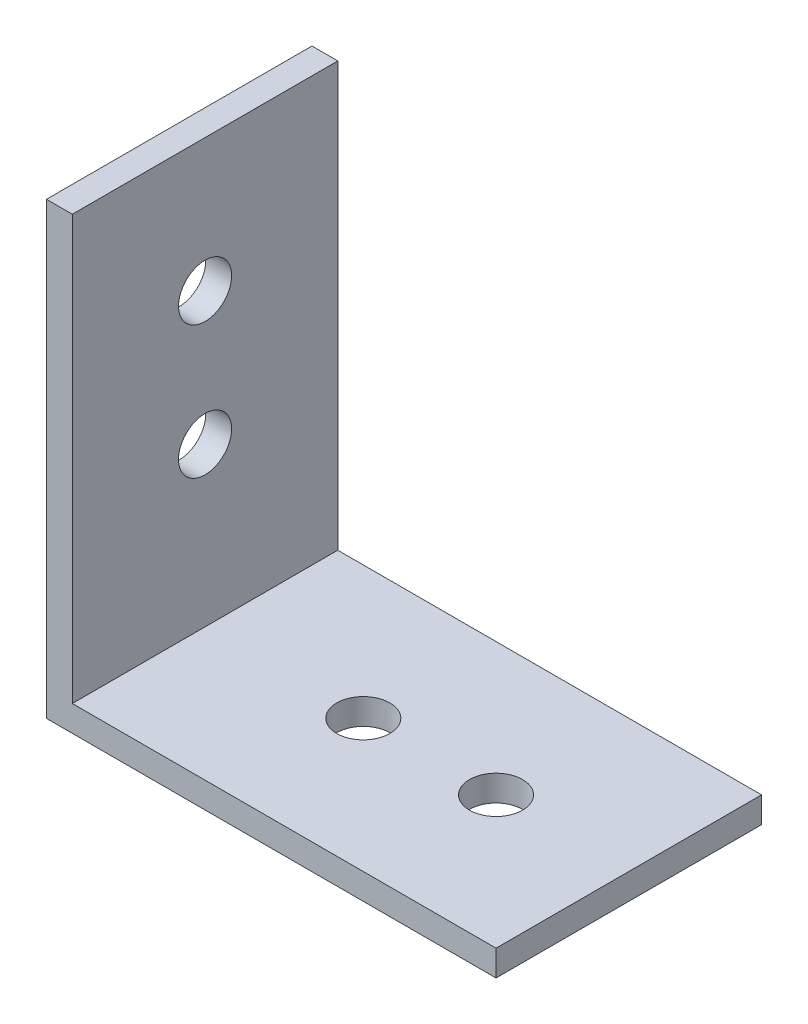
from build123d import *

# Parameters (mm, degrees)
SKETCH1_W           = 15
SKETCH1_H           = 25.4
BOSS_EXTRUDE1_DEPTH = 3.175
SKETCH2_W           = 15
SKETCH2_H           = 3.175
BOSS_EXTRUDE2_DEPTH = 22.225
SKETCH4_R           = 1.5
CUT_EXTRUDE3_DEPTH  = 37.933868265
SKETCH3_R           = 1.5
CUT_EXTRUDE4_DEPTH  = 39.927111375
SKETCH7_W           = 22.225
SKETCH7_H           = 15
CUT_EXTRUDE7_DEPTH  = 1.7145
SKETCH8_W           = 15
SKETCH8_H           = 23.9395
CUT_EXTRUDE8_DEPTH  = 1.7145


with BuildPart() as part:
    # Sketch1 → Boss-Extrude1 (new body)
    with BuildSketch(Plane(origin=(0, 0, 0), x_dir=(0, 0, -1), z_dir=(1, 0, 0))):
        with Locations((7.5, 12.7)):
            Rectangle(SKETCH1_W, SKETCH1_H)
    extrude(amount=BOSS_EXTRUDE1_DEPTH)

    # Sketch2 → Boss-Extrude2 (add)
    with BuildSketch(Plane(origin=(3.175, 0, 0), x_dir=(0, 0, -1), z_dir=(1, 0, 0))):
        with Locations((7.5, 1.5875)):
            Rectangle(SKETCH2_W, SKETCH2_H)
    extrude(amount=BOSS_EXTRUDE2_DEPTH)

    # Sketch4 → Cut-Extrude3 (cut, through all)
    with BuildSketch(Plane(origin=(3.175, 0, 0), x_dir=(0, 0, -1), z_dir=(1, 0, 0))):
        with Locations((7.5, 17.9)):
            Circle(SKETCH4_R)
        with Locations((7.5, 10.4)):
            Circle(SKETCH4_R)
    extrude(amount=-CUT_EXTRUDE3_DEPTH, mode=Mode.SUBTRACT)

    # Sketch3 → Cut-Extrude4 (cut, through all)
    with BuildSketch(Plane.XZ):
        with Locations(Location((10.4, -7.5, 0), (0, 0, 270))):
            Circle(SKETCH3_R)
        with Locations(Location((17.9, -7.5, 0), (0, 0, 270))):
            Circle(SKETCH3_R)
    extrude(amount=-CUT_EXTRUDE4_DEPTH, mode=Mode.SUBTRACT)

    # Sketch7 → Cut-Extrude7 (cut)
    with BuildSketch(Plane(origin=(0, 3.175, 0), x_dir=(1, 0, 0), z_dir=(0, 1, 0))):
        with Locations((14.2875, 7.5)):
            Rectangle(SKETCH7_W, SKETCH7_H)
    extrude(amount=-CUT_EXTRUDE7_DEPTH, mode=Mode.SUBTRACT)

    # Sketch8 → Cut-Extrude8 (cut)
    with BuildSketch(Plane(origin=(3.175, 0, 0), x_dir=(0, 0, -1), z_dir=(1, 0, 0))):
        with Locations((7.5, 13.43025)):
            Rectangle(SKETCH8_W, SKETCH8_H)
    extrude(amount=-CUT_EXTRUDE8_DEPTH, mode=Mode.SUBTRACT)


solid = part.part
